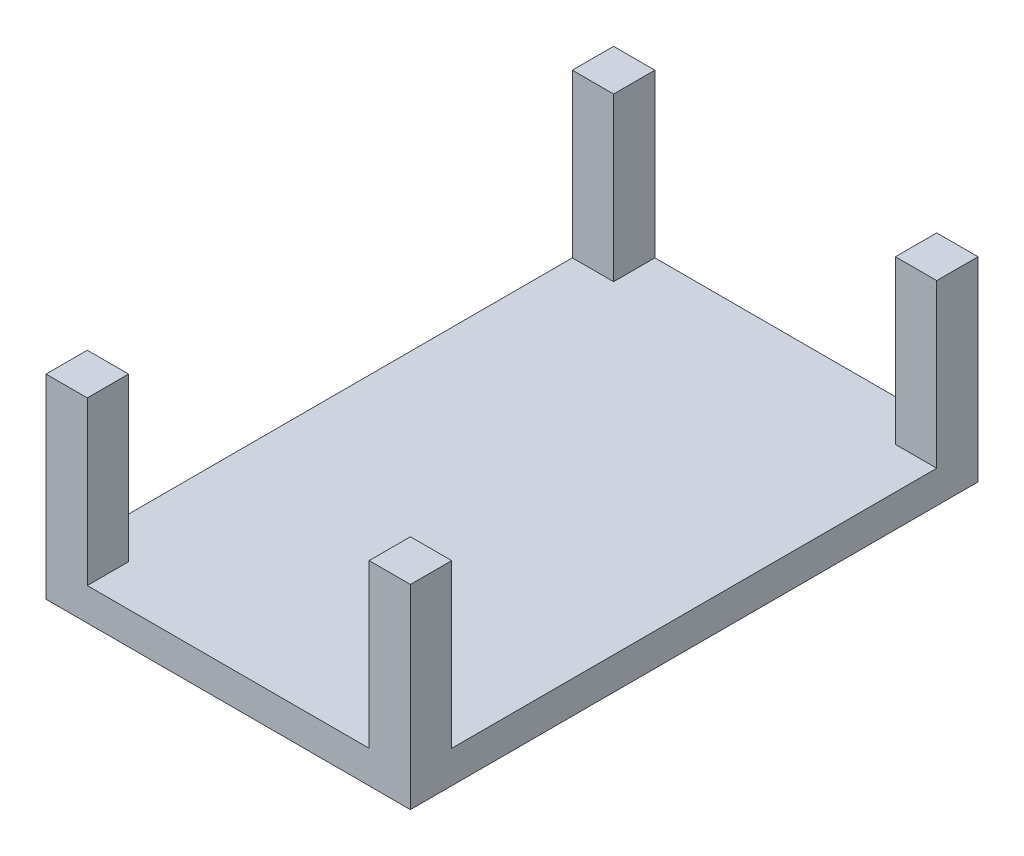
from build123d import *

# Parameters (mm, degrees)
CROQUIS1_4_W              = 50.8
CROQUIS1_4_H              = 50.8
SALIENTE_EXTRUIR3_DEPTH   = 240
SALIENTE_EXTRUIR3_2_DEPTH = 240
SALIENTE_EXTRUIR3_3_DEPTH = 240
SALIENTE_EXTRUIR3_4_DEPTH = 240
SALIENTE_EXTRUIR4_START   = -240
CROQUIS1_5_W              = 346.8
CROQUIS1_5_H              = 596.8
CROQUIS1_5_W_2            = 50.8
CROQUIS1_5_H_2            = 50.8
SALIENTE_EXTRUIR4_DEPTH   = 40


with BuildPart() as part:
    # Croquis1<4> → Saliente-Extruir3 (new body)
    with BuildSketch(Plane(origin=(0, 0, 0), x_dir=(1, 0, 0), z_dir=(0, 1, 0))):
        with Locations((-423, -323.8)):
            Rectangle(CROQUIS1_4_W, CROQUIS1_4_H)
    extrude(amount=-SALIENTE_EXTRUIR3_DEPTH)



with BuildPart() as body_2:
    # Croquis1<4> → Saliente-Extruir3 2 (new body)
    with BuildSketch(Plane(origin=(0, 0, 0), x_dir=(1, 0, 0), z_dir=(0, 1, 0))):
        with Locations((-423, 323.8)):
            Rectangle(CROQUIS1_4_W, CROQUIS1_4_H)
    extrude(amount=-SALIENTE_EXTRUIR3_2_DEPTH)


with BuildPart() as body_3:
    # Croquis1<4> → Saliente-Extruir3 3 (new body)
    with BuildSketch(Plane(origin=(0, 0, 0), x_dir=(1, 0, 0), z_dir=(0, 1, 0))):
        with Locations((-25.4, 323.8)):
            Rectangle(CROQUIS1_4_W, CROQUIS1_4_H)
    extrude(amount=-SALIENTE_EXTRUIR3_3_DEPTH)


with BuildPart() as body_4:
    # Croquis1<4> → Saliente-Extruir3 4 (new body)
    with BuildSketch(Plane(origin=(0, 0, 0), x_dir=(1, 0, 0), z_dir=(0, 1, 0))):
        with Locations((-25.4, -323.8)):
            Rectangle(CROQUIS1_4_W, CROQUIS1_4_H)
    extrude(amount=-SALIENTE_EXTRUIR3_4_DEPTH)


with BuildPart() as part_1:
    add(part.part)

    add(body_2.part)  # Saliente-Extruir4 merges body 2

    add(body_3.part)  # Saliente-Extruir4 merges body 3

    add(body_4.part)  # Saliente-Extruir4 merges body 4
    # Croquis1<5> → Saliente-Extruir4 (add)
    with BuildSketch(Plane(origin=(0, 0, 0), x_dir=(1, 0, 0), z_dir=(0, 1, 0)).offset(SALIENTE_EXTRUIR4_START)):
        with Locations((-224.2, 0)):
            Rectangle(CROQUIS1_5_W, CROQUIS1_5_H)
        with Locations((-25.4, 0)):
            Rectangle(CROQUIS1_5_W_2, CROQUIS1_5_H)
        with Locations((-224.2, -323.8)):
            Rectangle(CROQUIS1_5_W, CROQUIS1_5_H_2)
        with Locations((-423, 0)):
            Rectangle(CROQUIS1_5_W_2, CROQUIS1_5_H)
        with Locations((-224.2, 323.8)):
            Rectangle(CROQUIS1_5_W, CROQUIS1_5_H_2)
        with Locations((-423, 323.8)):
            Rectangle(CROQUIS1_5_W_2, CROQUIS1_5_H_2)
        with Locations((-25.4, 323.8)):
            Rectangle(CROQUIS1_5_W_2, CROQUIS1_5_H_2)
        with Locations((-25.4, -323.8)):
            Rectangle(CROQUIS1_5_W_2, CROQUIS1_5_H_2)
        with Locations((-423, -323.8)):
            Rectangle(CROQUIS1_5_W_2, CROQUIS1_5_H_2)
    extrude(amount=SALIENTE_EXTRUIR4_DEPTH)


solid = part_1.part
